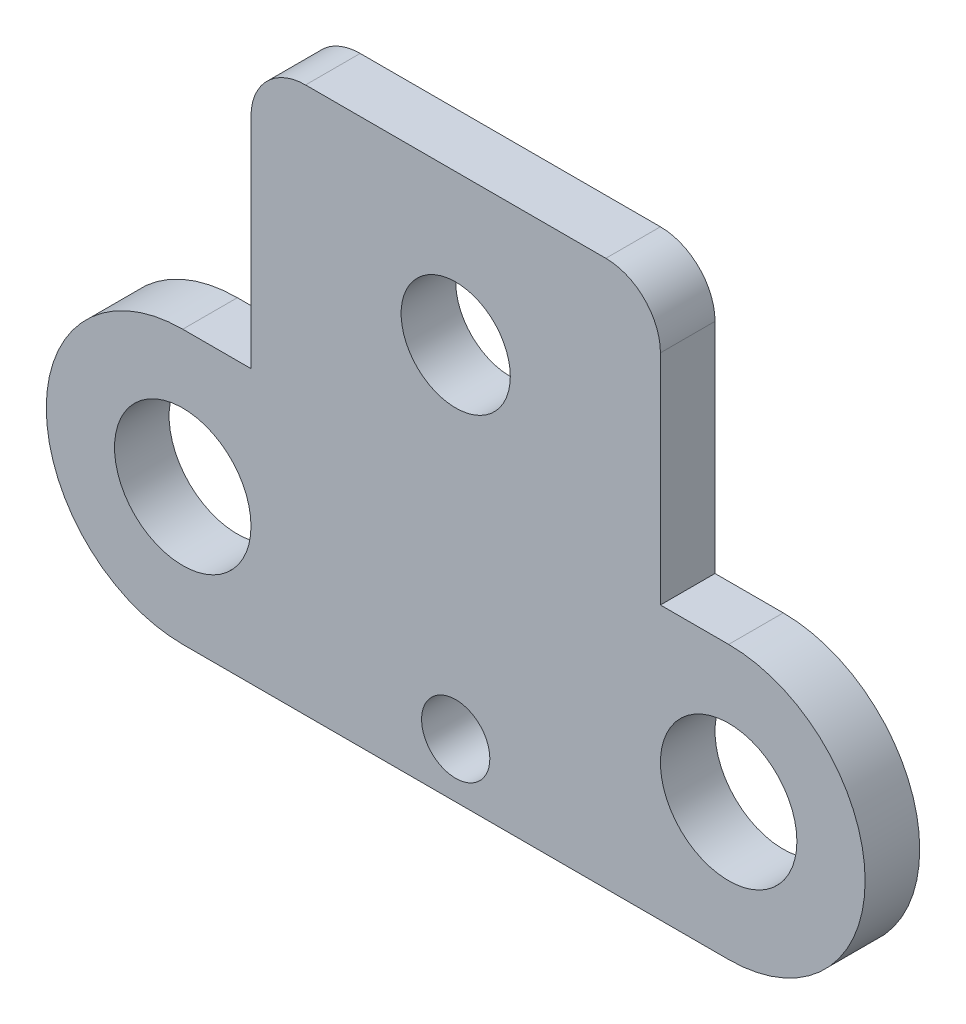
from build123d import *

# Parameters (mm, degrees)
SKETCH1_R           = 2.5
SKETCH1_R_2         = 1.25
BOSS_EXTRUDE1_DEPTH = 1
SKETCH2_W           = 15
SKETCH2_H           = 10
SKETCH2_R           = 2
BOSS_EXTRUDE2_DEPTH = 1
FILLET1_R           = 2


with BuildPart() as part:
    # Sketch1 → Boss-Extrude1 (new, symmetric)
    with BuildSketch(Plane.XY):
        with BuildLine():
            Line((0, 5), (20, 5))
            ThreePointArc((20, 5), (25, 0), (20, -5))
            Line((20, -5), (0, -5))
            ThreePointArc((0, -5), (-5, 0), (0, 5))
        make_face()
        Circle(SKETCH1_R, mode=Mode.SUBTRACT)
        with Locations((20, 0)):
            Circle(SKETCH1_R, mode=Mode.SUBTRACT)
        with Locations((10, -3)):
            Circle(SKETCH1_R_2, mode=Mode.SUBTRACT)
    extrude(amount=BOSS_EXTRUDE1_DEPTH, both=True)

    # Sketch2 → Boss-Extrude2 (add, symmetric)
    with BuildSketch(Plane.XY):
        with Locations((10, 10)):
            Rectangle(SKETCH2_W, SKETCH2_H)
        with Locations((10, 9.5)):
            Circle(SKETCH2_R, mode=Mode.SUBTRACT)
    extrude(amount=BOSS_EXTRUDE2_DEPTH, both=True)

    # Fillet1
    fillet1_edges = [part.edges().sort_by_distance(p)[0] for p in [
        (2.5, 15, 0),
        (17.5, 15, 0),
    ]]
    fillet(fillet1_edges, radius=FILLET1_R)


solid = part.part
